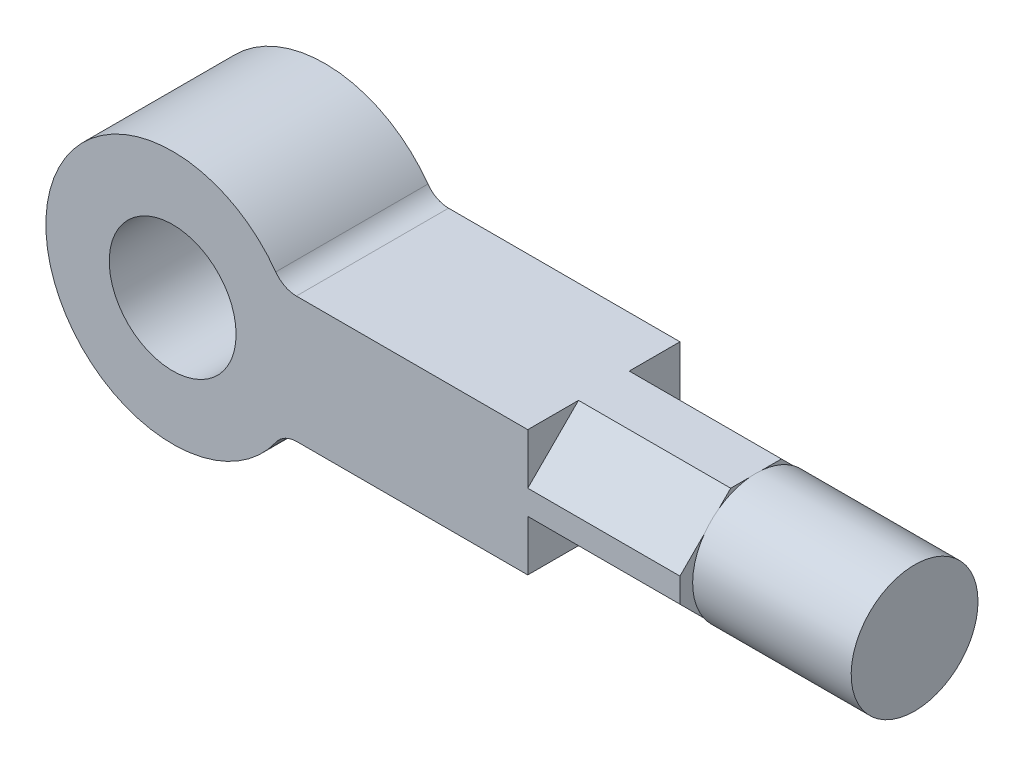
from build123d import *

# Parameters (mm, degrees)
SKETCH1_R           = 10
BOSS_EXTRUDE4_DEPTH = 24
CUT_EXTRUDE1_DEPTH  = 24
SKETCH8_R           = 10
BOSS_EXTRUDE5_DEPTH = 25


with BuildPart() as part:
    # Sketch1 → Boss-Extrude4 (new body)
    with BuildSketch(Plane.XY):
        with BuildLine():
            Line((19.506185094, 9.982444102), (80, 9.982444102))
            Line((80, 9.982444102), (80, -9.863013699))
            Line((80, -9.863013699), (19.591244248, -9.863013699))
            ThreePointArc((19.591244248, -9.863013699), (17.753039843, -10.310408378), (16.326036873, -11.552511416))
            ThreePointArc((16.326036873, -11.552511416), (-19.99990669, -0.061093452), (16.255154245, 11.652036752))
            ThreePointArc((16.255154245, 11.652036752), (17.678841312, 10.424240243), (19.506185094, 9.982444102))
        make_face()
        Circle(SKETCH1_R, mode=Mode.SUBTRACT)
    extrude(amount=BOSS_EXTRUDE4_DEPTH)

    # Sketch7 → Cut-Extrude1 (cut)
    with BuildSketch(Plane(origin=(80, 0, 0), x_dir=(0, 0, -1), z_dir=(1, 0, 0))):
        Polygon((-8, 9.982444102), (0, 9.982444102), (0, 1.982444102), align=None)
        Polygon((-24, 9.982444102), (-16, 9.982444102), (-24, 1.982444102), align=None)
        Polygon((-24, -9.863013699), (-24, -1.863013699), (-16, -9.863013699), align=None)
        Polygon((0, -9.863013699), (0, -1.863013699), (-8, -9.863013699), align=None)
    extrude(amount=-CUT_EXTRUDE1_DEPTH, mode=Mode.SUBTRACT)

    # Sketch8 → Boss-Extrude5 (add)
    with BuildSketch(Plane(origin=(80, 0, 0), x_dir=(0, 0, -1), z_dir=(1, 0, 0))):
        with Locations(Location((-12, 0.029857601, 0), (0, 0, 214.226665148))):
            Circle(SKETCH8_R)
    extrude(amount=BOSS_EXTRUDE5_DEPTH)


solid = part.part
